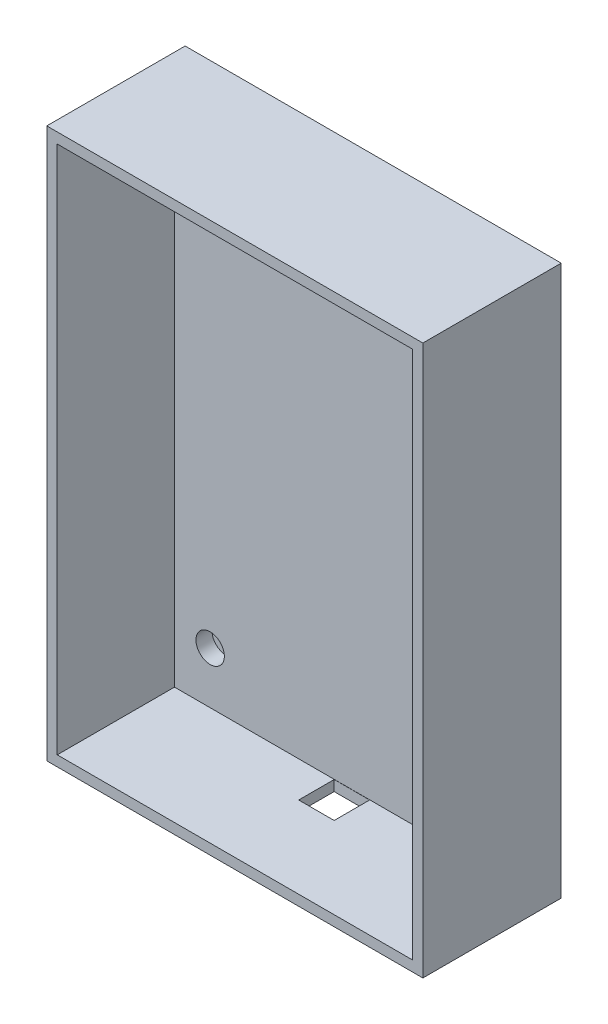
from build123d import *

# Parameters (mm, degrees)
SKETCH_1_W                   = 106
SKETCH_1_H                   = 155
EXTRUDE_1_DEPTH              = 36
SHELL_1_T                    = -2.95
SKETCH_2_W                   = 10
SKETCH_2_H                   = 10
CUT_EXTRUDE_1_DEPTH          = 36
SKETCH_3_W                   = 106
SKETCH_3_H                   = 155
EXTRUDE_2_DEPTH              = 3
HOLE_WIZARD_M4_1_D           = 4.5
HOLE_WIZARD_M4_1_DEPTH       = 45
HOLE_WIZARD_M4_1_CBORE_D     = 8
HOLE_WIZARD_M4_1_CBORE_DEPTH = 4.5
HOLE_WIZARD_M4_1_TIP         = 1.351936393


with BuildPart() as part:
    # 스케치1 → 보스-돌출1 (new body)
    with BuildSketch(Plane.XY):
        Rectangle(SKETCH_1_W, SKETCH_1_H)
    extrude(amount=EXTRUDE_1_DEPTH)

    # 쉘1
    shell_1_openings = [part.faces().sort_by_distance(p)[0] for p in [
        (0, 0, 36),
    ]]
    offset(amount=SHELL_1_T, openings=shell_1_openings, kind=Kind.INTERSECTION)

    # 스케치2 → 컷-돌출1 (cut)
    with BuildSketch(Plane.XZ.offset(77.5)):
        with Locations((0, 8)):
            Rectangle(SKETCH_2_W, SKETCH_2_H)
    extrude(amount=-CUT_EXTRUDE_1_DEPTH, mode=Mode.SUBTRACT)

    # 스케치3 → 보스-돌출2 (add)
    with BuildSketch(Plane(origin=(0, 0, 0), x_dir=(-1, 0, 0), z_dir=(0, 0, -1))):
        Rectangle(SKETCH_3_W, SKETCH_3_H)
    extrude(amount=EXTRUDE_2_DEPTH)

    # M4 소켓 머리 캡 나사용 카운터보어1
    with Locations(Plane.XY.offset(2.95)):
        with Locations((-40, 60), (40, 60), (40, -60), (-40, -60)):
            CounterBoreHole(HOLE_WIZARD_M4_1_D / 2, HOLE_WIZARD_M4_1_CBORE_D / 2, HOLE_WIZARD_M4_1_CBORE_DEPTH, depth=HOLE_WIZARD_M4_1_DEPTH)
            with Locations((0, 0, -(HOLE_WIZARD_M4_1_DEPTH + HOLE_WIZARD_M4_1_TIP / 2))):  # 118° drill point
                Cone(0, HOLE_WIZARD_M4_1_D / 2, HOLE_WIZARD_M4_1_TIP, mode=Mode.SUBTRACT)


solid = part.part
